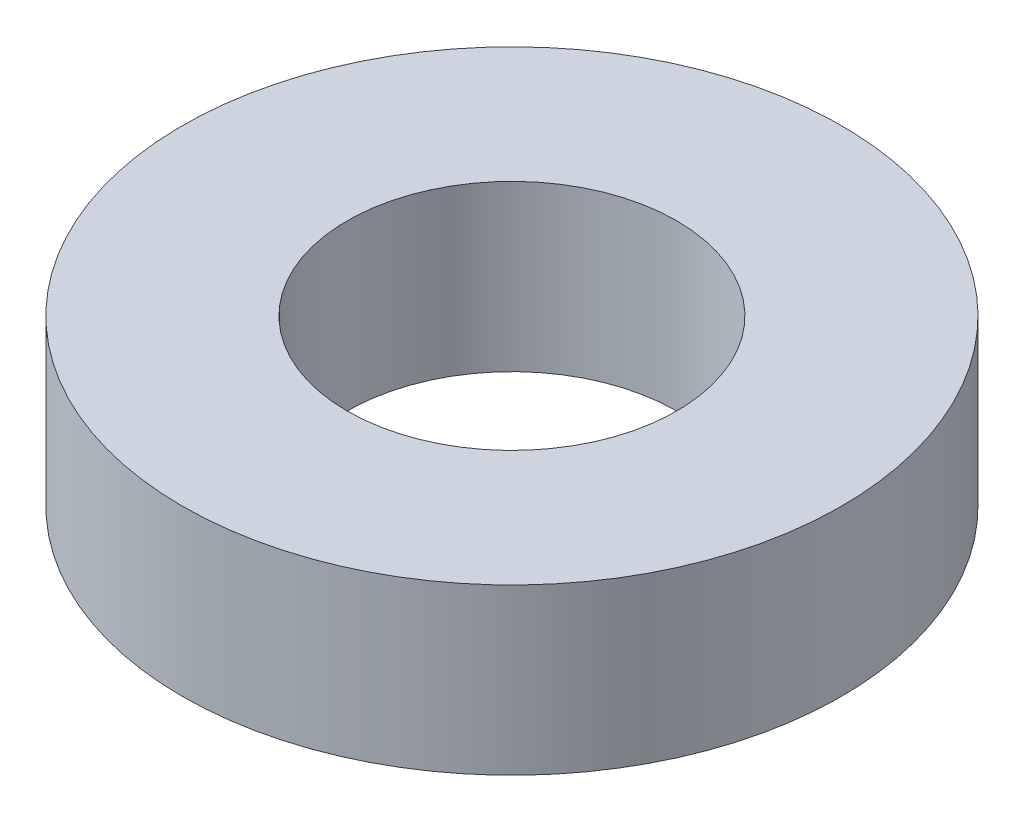
from build123d import *

# Parameters (mm, degrees)
SKETCH1_R           = 200
SKETCH1_R_2         = 100
BOSS_EXTRUDE1_DEPTH = 50


with BuildPart() as part:
    # Sketch1 → Boss-Extrude1 (new, symmetric)
    with BuildSketch(Plane(origin=(0, 0, 0), x_dir=(1, 0, 0), z_dir=(0, 1, 0))):
        with Locations(Location((0, 0, 0), (0, 0, 270))):
            Circle(SKETCH1_R)
        with Locations(Location((0, 0, 0), (0, 0, 270))):
            Circle(SKETCH1_R_2, mode=Mode.SUBTRACT)
    extrude(amount=BOSS_EXTRUDE1_DEPTH, both=True)


solid = part.part
